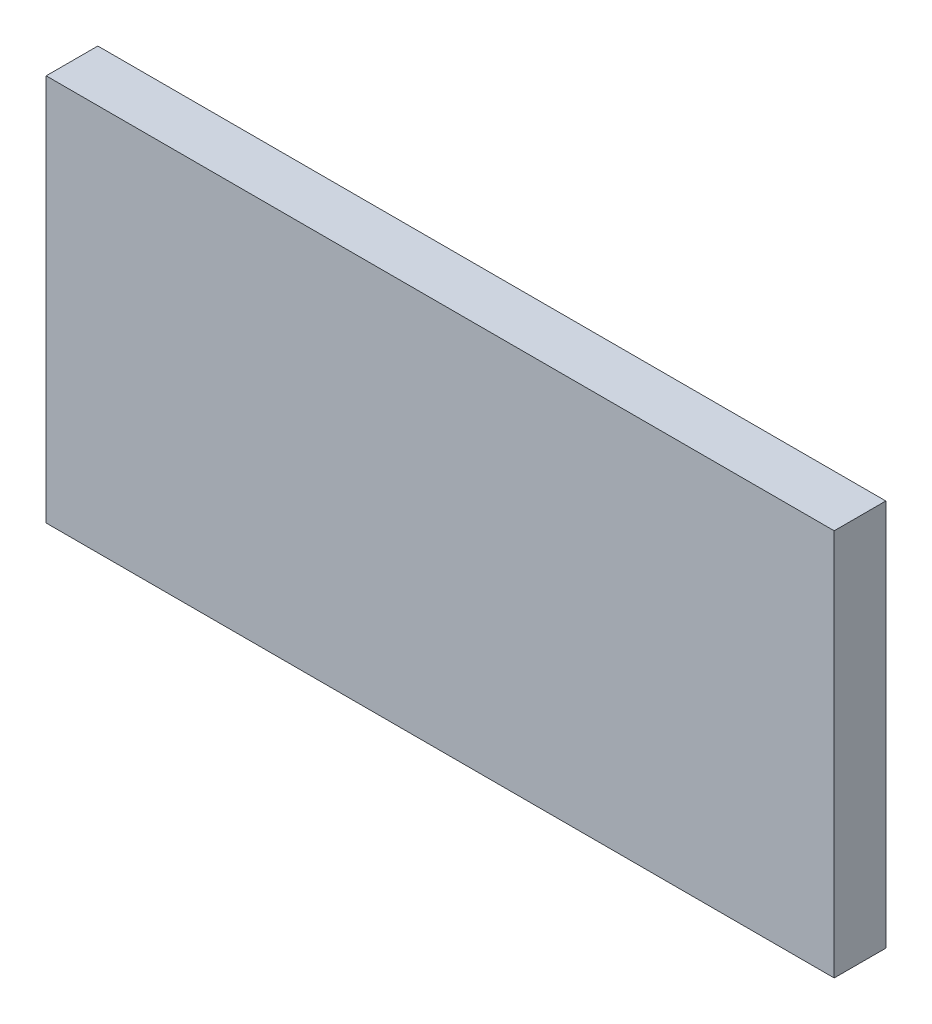
from build123d import *

# Parameters (mm, degrees)
ESBO_O1_W                = 61.038729438
ESBO_O1_H                = 30
RESSALTO_EXTRUS_O1_DEPTH = 4


with BuildPart() as part:
    # Esboço1 → Ressalto-extrusão1 (new body)
    with BuildSketch(Plane.XY):
        Rectangle(ESBO_O1_W, ESBO_O1_H)
    extrude(amount=RESSALTO_EXTRUS_O1_DEPTH)


solid = part.part
